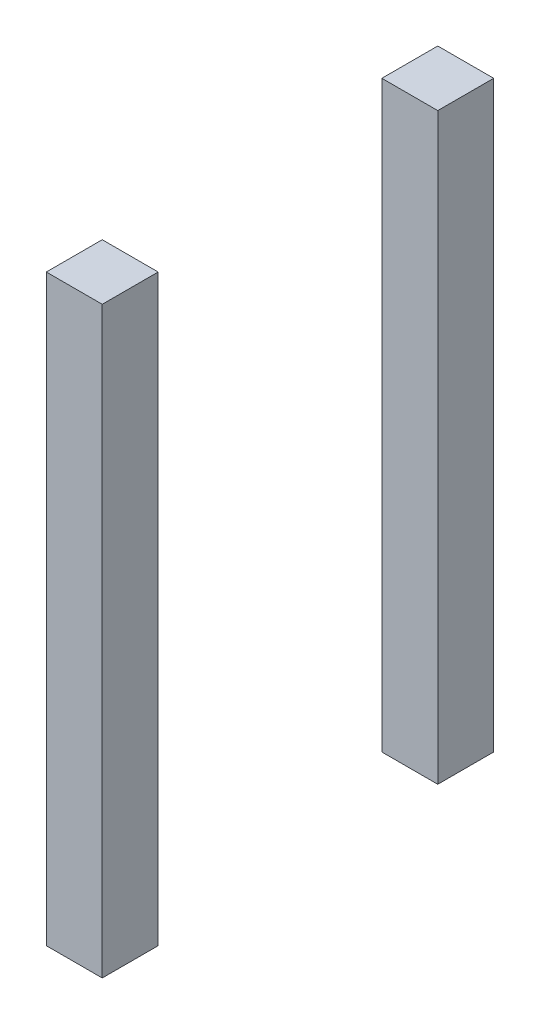
from build123d import *

# Parameters (mm, degrees)
SKETCH1_W             = 9.271
SKETCH1_H             = 9.271
BOSS_EXTRUDE1_DEPTH   = 96.731666667
BOSS_EXTRUDE1_2_DEPTH = 96.731666667


with BuildPart() as part:
    # Sketch1 → Boss-Extrude1 (new body)
    with BuildSketch(Plane(origin=(0, -45.00889512, 0), x_dir=(1, 0, 0), z_dir=(0, 1, 0))):
        with Locations((-71.94339959, -45.717920544)):
            Rectangle(SKETCH1_W, SKETCH1_H)
    extrude(amount=BOSS_EXTRUDE1_DEPTH)


with BuildPart() as body_2:
    # Sketch1 → Boss-Extrude1 2 (new body)
    with BuildSketch(Plane(origin=(0, -45.00889512, 0), x_dir=(1, 0, 0), z_dir=(0, 1, 0))):
        with Locations((-71.94339959, 9.908079456)):
            Rectangle(SKETCH1_W, SKETCH1_H)
    extrude(amount=BOSS_EXTRUDE1_2_DEPTH)


solid = Compound([part.part, body_2.part])
